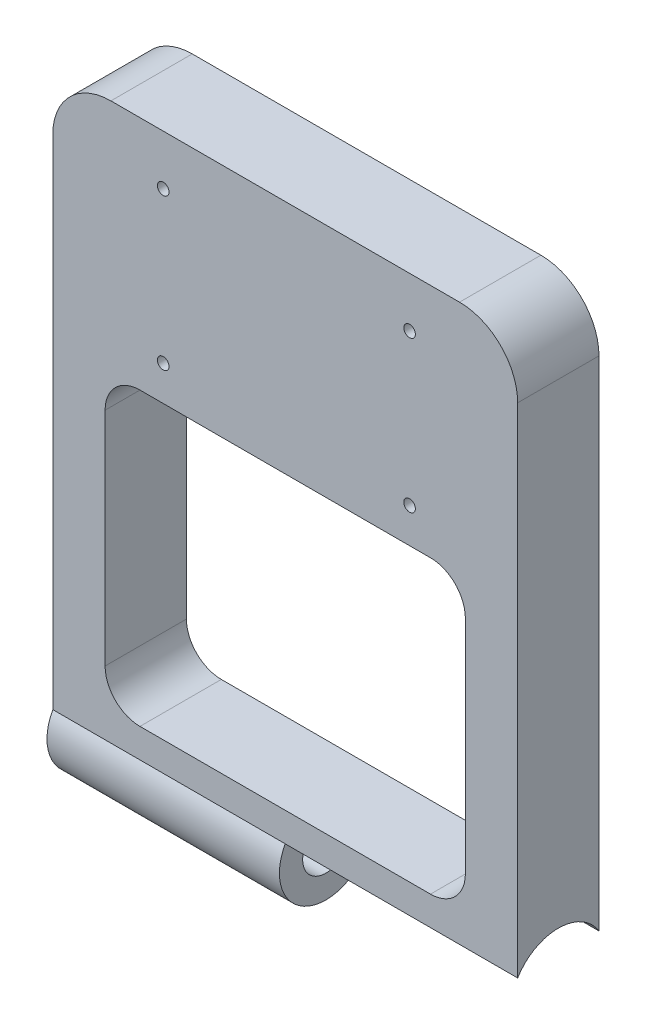
from build123d import *

# Parameters (mm, degrees)
SKETCH1_W                = 40
SKETCH1_H                = 50
BOSS_EXTRUDE1_DEPTH      = 7
SKETCH2_R                = 4.1
CUT_EXTRUDE1_DEPTH       = 20
BOSS_EXTRUDE2_DEPTH      = 11
BOSS_EXTRUDE2_DEPTH_BACK = 9
SKETCH3_R                = 4
SKETCH3_R_2              = 2
FILLET1_R                = 5
SKETCH4_R                = 0.5
SKETCH4_W                = 31
SKETCH4_H                = 25.064584349
CUT_EXTRUDE2_DEPTH       = 45.095541639
FILLET2_R                = 3
SKETCH5_R                = 2
CUT_EXTRUDE3_DEPTH       = 56.229329833


with BuildPart() as part:
    # Sketch1 → Boss-Extrude1 (new body)
    with BuildSketch(Plane.XY):
        with Locations((-2.229213179, -8.535620053)):
            Rectangle(SKETCH1_W, SKETCH1_H)
    extrude(amount=BOSS_EXTRUDE1_DEPTH)

    # Sketch2 → Cut-Extrude1 (cut)
    with BuildSketch(Plane(origin=(17.770786821, 0, 0), x_dir=(0, 0, -1), z_dir=(1, 0, 0))):
        with Locations((-3.5, -33.535620053)):
            Circle(SKETCH2_R)
    extrude(amount=-CUT_EXTRUDE1_DEPTH, mode=Mode.SUBTRACT)

    # Sketch3 → Boss-Extrude2 (add, two sides: drawn at the far end of the back side and taken through both)
    with BuildSketch(Plane(origin=(-13.229213179, 0, 0), x_dir=(0, 0, -1), z_dir=(1, 0, 0)).offset(-BOSS_EXTRUDE2_DEPTH_BACK)):
        with Locations((-3.5, -33.336696075)):
            Circle(SKETCH3_R)
        with Locations((-3.5, -33.336696075)):
            Circle(SKETCH3_R_2, mode=Mode.SUBTRACT)
    extrude(amount=BOSS_EXTRUDE2_DEPTH + BOSS_EXTRUDE2_DEPTH_BACK)

    # Fillet1
    fillet1_edges = [part.edges().sort_by_distance(p)[0] for p in [
        (-22.229213179, 16.464379947, 3.5),
        (17.770786821, 16.464379947, 3.5),
    ]]
    fillet(fillet1_edges, radius=FILLET1_R)

    # Sketch4 → Cut-Extrude2 (cut, through all)
    with BuildSketch(Plane(origin=(0, 0, 0), x_dir=(-1, 0, 0), z_dir=(0, 0, -1))):
        with Locations((-8.470786821, 12.164379947)):
            Circle(SKETCH4_R)
        with Locations((12.729213179, 12.164379947)):
            Circle(SKETCH4_R)
        with Locations((12.729213179, -0.835620053)):
            Circle(SKETCH4_R)
        with Locations((-8.470786821, -0.835620053)):
            Circle(SKETCH4_R)
        with Locations((2.229213179, -16.367912228)):
            Rectangle(SKETCH4_W, SKETCH4_H)
    extrude(amount=-CUT_EXTRUDE2_DEPTH, mode=Mode.SUBTRACT)

    # Fillet2
    fillet2_edges = [part.edges().sort_by_distance(p)[0] for p in [
        (-17.729213179, -3.835620053, 3.5),
        (-17.729213179, -28.900204402, 3.5),
        (13.270786821, -28.900204402, 3.5),
        (13.270786821, -3.835620053, 3.5),
    ]]
    fillet(fillet2_edges, radius=FILLET2_R)

    # Sketch5 → Cut-Extrude3 (cut, through all)
    with BuildSketch(Plane.ZY.offset(22.229213179)):
        with Locations(Location((3.5, -33.336696075, 0), (0, 0, 90))):
            Circle(SKETCH5_R)
    extrude(amount=-CUT_EXTRUDE3_DEPTH, mode=Mode.SUBTRACT)


solid = part.part
